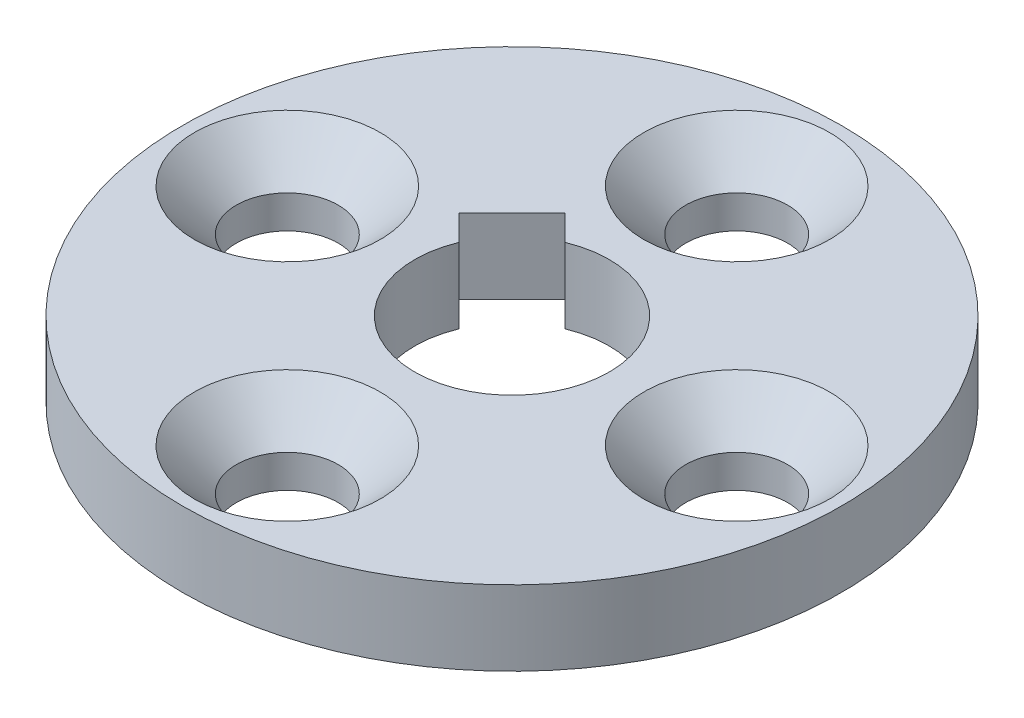
from build123d import *

# Parameters (mm, degrees)
SKETCH1_R                                    = 11
BOSS_EXTRUDE1_DEPTH                          = 2.5
CSK_FOR_M3_SOCKET_COUNTERSUNK_HEAD_S_2_COUNT = 2
CSK_FOR_M3_SOCKET_COUNTERSUNK_HEAD_S_2_PITCH = 10.606601718
CSK_FOR_M3_SOCKET_COUNTERSUNK_HEAD_S_3_COUNT = 2
CSK_FOR_M3_SOCKET_COUNTERSUNK_HEAD_S_3_PITCH = 15
CSK_FOR_M3_SOCKET_COUNTERSUNK_HEAD_S_4_COUNT = 2
CSK_FOR_M3_SOCKET_COUNTERSUNK_HEAD_S_4_PITCH = 10.606601718
CUT_EXTRUDE1_DEPTH                           = 16.755951257


with BuildPart() as part:
    # Sketch1 → Boss-Extrude1 (new body)
    with BuildSketch(Plane(origin=(0, 0, 0), x_dir=(1, 0, 0), z_dir=(0, 1, 0))):
        with Locations(Location((0, 0, 0), (0, 0, 270))):
            Circle(SKETCH1_R)
    extrude(amount=BOSS_EXTRUDE1_DEPTH)

    # Sketch3 → CSK for M3 socket countersunk head screw1 (revolve, cut)
    with BuildSketch(Plane(origin=(-7.5, 2.5, 0), x_dir=(0, 0, 1), z_dir=(1, 0, 0))):
        Polygon((0, 0), (0, 2.5), (1.7, 2.5), (1.7, 1.4), (3.1, 0), align=None)
    csk_for_m3_socket_countersunk_head_screw = revolve(axis=Axis((-7.5, 8.85, 0), (0, -1, 0)), mode=Mode.SUBTRACT)

    # CSK for M3 socket countersunk head s 2: CSK for M3 socket countersunk head screw1 ×2
    with Locations(*[Vector(0.7071067811865303, 0, -0.7071067811865648) * (i * CSK_FOR_M3_SOCKET_COUNTERSUNK_HEAD_S_2_PITCH) for i in range(1, CSK_FOR_M3_SOCKET_COUNTERSUNK_HEAD_S_2_COUNT)]):
        add(csk_for_m3_socket_countersunk_head_screw, mode=Mode.SUBTRACT)

    # CSK for M3 socket countersunk head s 3: CSK for M3 socket countersunk head screw1 ×2
    with Locations(*[(i * CSK_FOR_M3_SOCKET_COUNTERSUNK_HEAD_S_3_PITCH, 0, 0) for i in range(1, CSK_FOR_M3_SOCKET_COUNTERSUNK_HEAD_S_3_COUNT)]):
        add(csk_for_m3_socket_countersunk_head_screw, mode=Mode.SUBTRACT)

    # CSK for M3 socket countersunk head s 4: CSK for M3 socket countersunk head screw1 ×2
    with Locations(*[Vector(0.7071067811865648, 0, 0.7071067811865303) * (i * CSK_FOR_M3_SOCKET_COUNTERSUNK_HEAD_S_4_PITCH) for i in range(1, CSK_FOR_M3_SOCKET_COUNTERSUNK_HEAD_S_4_COUNT)]):
        add(csk_for_m3_socket_countersunk_head_screw, mode=Mode.SUBTRACT)

    # Sketch4 → Cut-Extrude1 (cut, through all)
    with BuildSketch(Plane(origin=(0, 2.5, 0), x_dir=(1, 0, 0), z_dir=(0, 1, 0))):
        with BuildLine():
            Line((-2.085965005, 3.853731957), (-3.853731957, 2.085965005))
            Line((-3.853731957, 2.085965005), (-3.00520382, 1.237436867))
            ThreePointArc((-3.00520382, 1.237436867), (2.298097039, -2.298097039), (-1.237436867, 3.00520382))
            Line((-1.237436867, 3.00520382), (-2.085965005, 3.853731957))
        make_face()
    extrude(amount=-CUT_EXTRUDE1_DEPTH, mode=Mode.SUBTRACT)


solid = part.part
